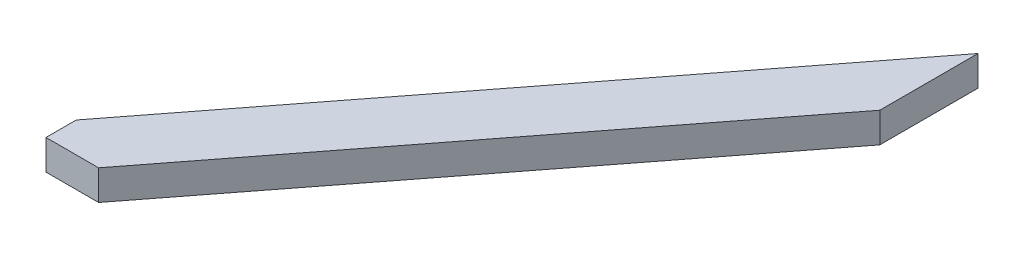
from build123d import *

# Parameters (mm, degrees)
BOSS_EXTRUDE1_DEPTH = 50.8


with BuildPart() as part:
    # Sketch2 → Boss-Extrude1 (new body)
    with BuildSketch(Plane.XZ.offset(-710.7)):
        Polygon((665, 1298.940331748), (0, 2158.673017045), (0, 2209.8), (88.9, 2209.8), (665, 1465), align=None)
    extrude(amount=BOSS_EXTRUDE1_DEPTH)


solid = part.part
